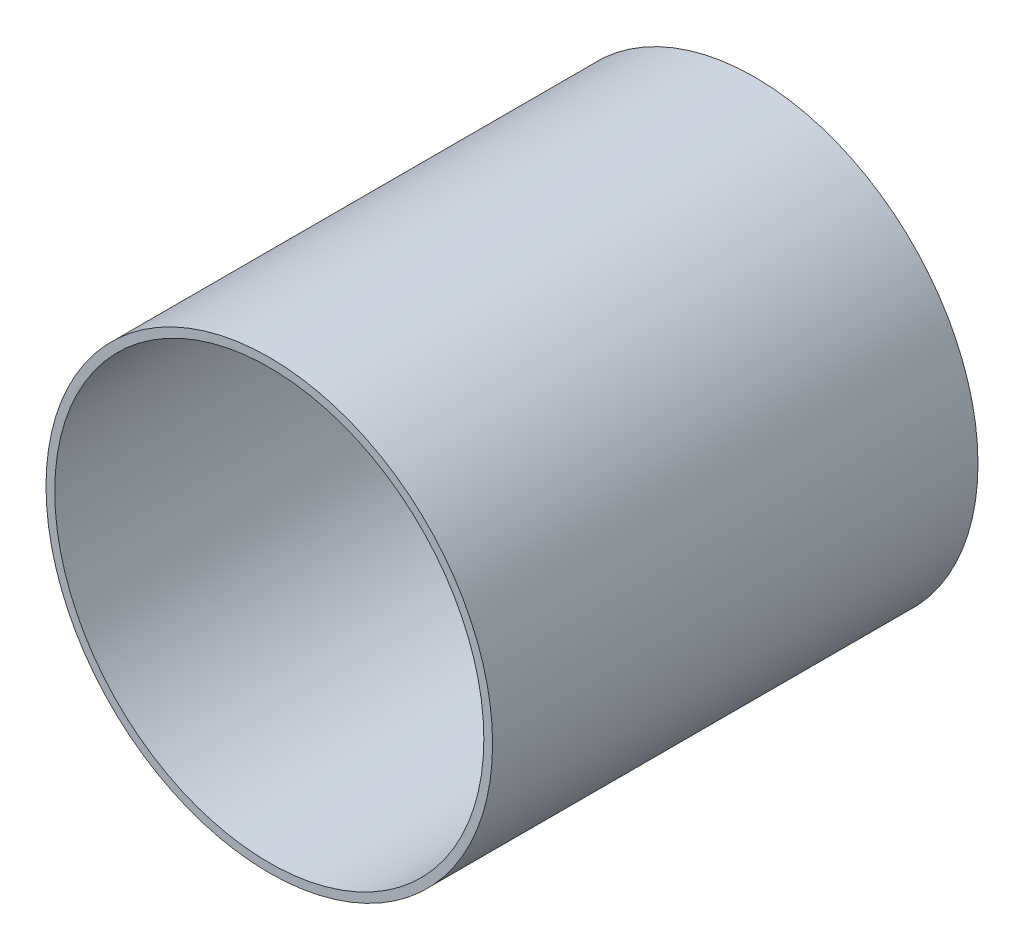
from build123d import *

# Parameters (mm, degrees)
SKETCH1_R           = 11.5
SKETCH1_R_2         = 11.05
BOSS_EXTRUDE1_DEPTH = 25


with BuildPart() as part:
    # Sketch1 → Boss-Extrude1 (new body)
    with BuildSketch(Plane.XY):
        Circle(SKETCH1_R)
        Circle(SKETCH1_R_2, mode=Mode.SUBTRACT)
    extrude(amount=BOSS_EXTRUDE1_DEPTH)


solid = part.part
